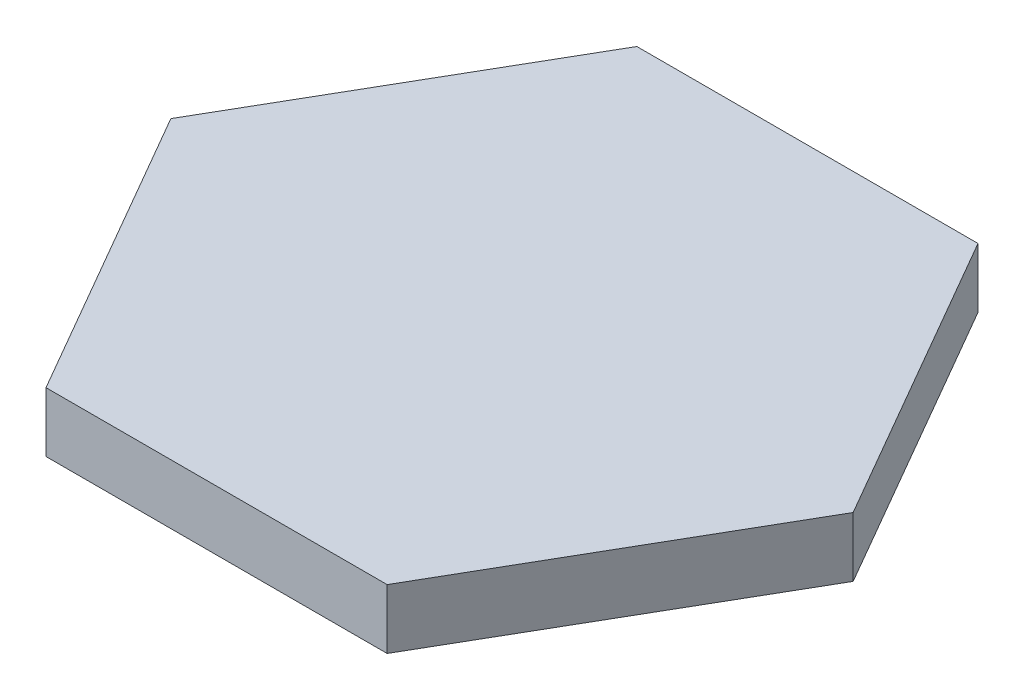
from build123d import *

# Parameters (mm, degrees)
BOSS_EXTRUDE1_DEPTH = 8


with BuildPart() as part:
    # Sketch1 → Boss-Extrude1 (new body)
    with BuildSketch(Plane(origin=(0, 0, 0), x_dir=(1, 0, 0), z_dir=(0, 1, 0))):
        Polygon((45.739997726, 0), (22.869998863, 39.612), (-22.869998863, 39.612), (-45.739997726, 0), (-22.869998863, -39.612), (22.869998863, -39.612), align=None)
    extrude(amount=BOSS_EXTRUDE1_DEPTH)


solid = part.part
